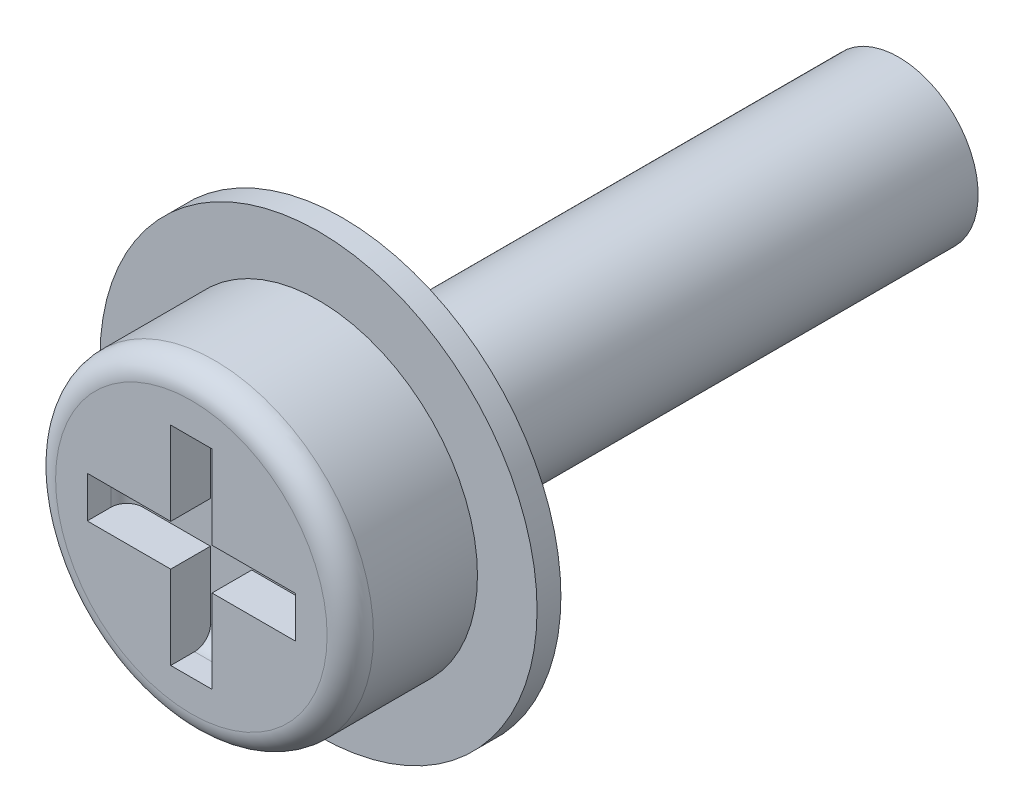
from build123d import *

# Parameters (mm, degrees)
ESQUISSE1_R             = 3.3
BOSS_EXTRU_1_DEPTH      = 0.36
ESQUISSE2_R             = 2.4
BOSS_EXTRU_2_DEPTH      = 1.92
ESQUISSE3_R             = 1.2
BOSS_EXTRU_3_DEPTH      = 8.4
CONG_1_R                = 0.35
ENL_V_MAT_EXTRU_1_DEPTH = 0.6
CONG_2_R                = 0.24


with BuildPart() as part:
    # Esquisse1 → Boss.-Extru.1 (new body)
    with BuildSketch(Plane.XY):
        with Locations(Location((0, 0, 0), (0, 0, 180))):
            Circle(ESQUISSE1_R)
    extrude(amount=BOSS_EXTRU_1_DEPTH)

    # Esquisse2 → Boss.-Extru.2 (add)
    with BuildSketch(Plane.XY.offset(0.36)):
        Circle(ESQUISSE2_R)
    extrude(amount=BOSS_EXTRU_2_DEPTH)

    # Esquisse3 → Boss.-Extru.3 (add)
    with BuildSketch(Plane(origin=(0, 0, 0), x_dir=(-1, 0, 0), z_dir=(0, 0, -1))):
        Circle(ESQUISSE3_R)
    extrude(amount=BOSS_EXTRU_3_DEPTH)

    # Congé1
    cong_1_edges = [part.edges().sort_by_distance(p)[0] for p in [
        (-2.4, 0, 2.28),
    ]]
    fillet(cong_1_edges, radius=CONG_1_R)

    # Esquisse4 → Enlèv. mat.-Extru.1 (cut)
    with BuildSketch(Plane.XY.offset(2.28)):
        Polygon((-1.572, -0.312), (-1.572, 0.312), (-0.312, 0.312), (-0.312, 1.572), (0.312, 1.572), (0.312, 0.312), (1.572, 0.312), (1.572, -0.312), (0.312, -0.312), (0.312, -1.572), (-0.312, -1.572), (-0.312, -0.312), align=None)
    extrude(amount=-ENL_V_MAT_EXTRU_1_DEPTH, mode=Mode.SUBTRACT)

    # Congé2
    cong_2_edges = [part.edges().sort_by_distance(p)[0] for p in [
        (-1.572, 0, 1.68),
        (0, 1.572, 1.68),
        (1.572, 0, 1.68),
        (0, -1.572, 1.68),
    ]]
    fillet(cong_2_edges, radius=CONG_2_R)


solid = part.part
